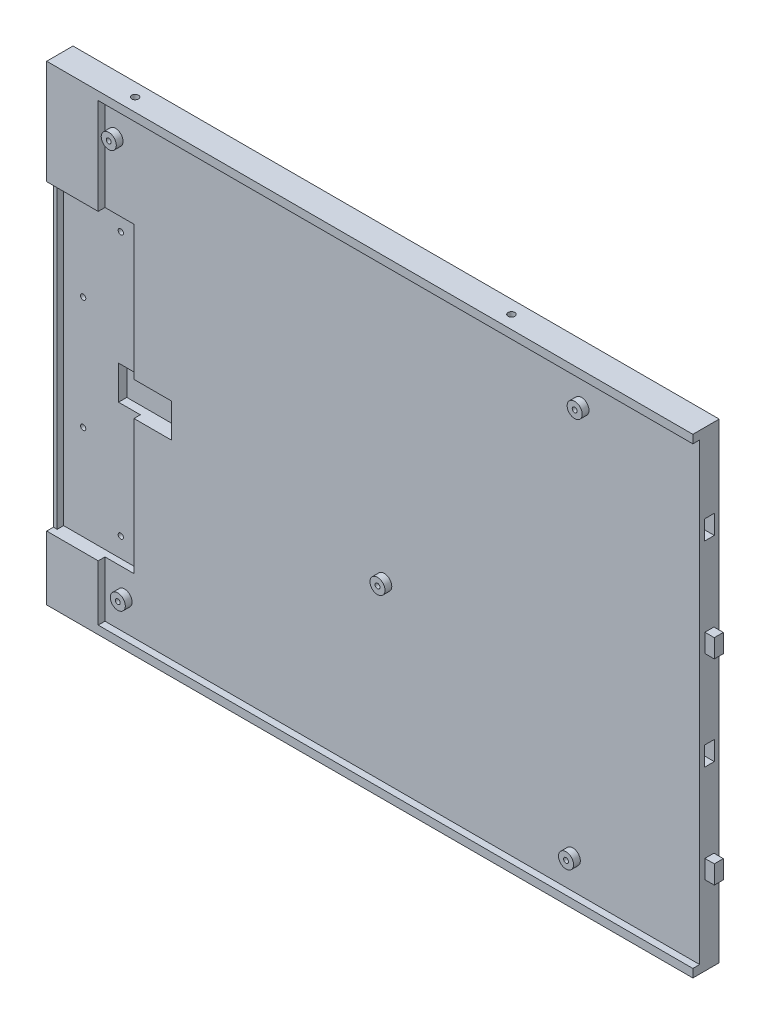
from build123d import *

# Parameters (mm, degrees)
SKETCH_1_W                      = 348.235
SKETCH_1_H                      = 124.714
EXTRUDE_1_DEPTH                 = 7
SKETCH_2_W                      = 344.235
SKETCH_2_H                      = 120.714
CUT_EXTRUDE_1_DEPTH             = 1.8
SKETCH_3_R                      = 2
SKETCH_3_R_2                    = 0.65
EXTRUDE_2_DEPTH                 = 1.8
CUT_EXTRUDE_2_DEPTH             = 370.930043415
CUT_EXTRUDE_2_DEPTH_BACK        = 1.7
SKETCH_4_W                      = 9.7
SKETCH_4_H                      = 80.4
SKETCH_6_W                      = 15.8
SKETCH_6_H                      = 9
CUT_EXTRUDE_3_DEPTH             = 3.9
SKETCH_7_W                      = 3.5
SKETCH_7_H                      = 80.4
EXTRUDE_3_DEPTH                 = 11.7
SKETCH_8_R                      = 0.7
CUT_EXTRUDE_4_DEPTH             = 3
SKETCH_9_W                      = 1
SKETCH_9_H                      = 80.4
EXTRUDE_4_DEPTH                 = 1.7
CUT_EXTRUDE_5_DEPTH             = 370.930043415
CUT_EXTRUDE_5_DEPTH_BACK        = 1.7
SKETCH_10_W                     = 20.2
SKETCH_10_H                     = 80.4
CUT_EXTRUDE_6_DEPTH             = 370.910052609
CUT_EXTRUDE_6_DEPTH_BACK        = 2.2
SKETCH_11_W                     = 15.8
SKETCH_11_H                     = 11.5
SKETCH_12_R                     = 0.65
CUT_EXTRUDE_7_DEPTH             = 3
SKETCH_13_W                     = 3
SKETCH_13_H                     = 124.714
EXTRUDE_5_DEPTH                 = 7
CUT_EXTRUDE_8_REACH             = 374.755
SKETCH_14_W                     = 6
SKETCH_14_H                     = 96.714
CUT_EXTRUDE_8_DIRECTION_2_DEPTH = 3
SKETCH_15_R                     = 2.6
CUT_EXTRUDE_9_DEPTH             = 0.7
SKETCH_15_3_R                   = 1
CUT_EXTRUDE_10_DEPTH            = 2.8
SKETCH_16_W                     = 362.935
SKETCH_16_H                     = 7
EXTRUDE_6_DEPTH                 = 0.2
SKETCH_17_W                     = 362.935
SKETCH_17_H                     = 7
EXTRUDE_7_DEPTH                 = 0.2
SKETCH_18_W                     = 10.4
SKETCH_18_H                     = 8.2
CUT_EXTRUDE_11_DEPTH            = 1.2
SKETCH_19_W                     = 4.2
SKETCH_19_H                     = 4.6
CUT_EXTRUDE_12_DEPTH            = 2.2
SKETCH_20_W                     = 10
SKETCH_20_H                     = 0.5
EXTRUDE_8_DEPTH                 = 0.8
SKETCH_21_W                     = 5.8
SKETCH_21_H                     = 1.6
EXTRUDE_9_DEPTH                 = 2.2
SKETCH_22_W                     = 13
SKETCH_22_H                     = 13
CUT_EXTRUDE_13_DEPTH            = 2.8
SKETCH_23_R                     = 5.6
SKETCH_23_R_2                   = 4.1
CUT_EXTRUDE_14_DEPTH            = 1
SKETCH_24_R                     = 0.9
CUT_EXTRUDE_15_DEPTH            = 3
CUT_EXTRUDE_START               = -122.114
SKETCH_24_2_R                   = 0.9
CUT_EXTRUDE_16_DEPTH            = 3
CUT_EXTRUDE_8779_DEPTH          = 373.822441145
CUT_EXTRUDE_8779_DEPTH_BACK     = 373.822441145
SKETCH_25_OUTSIDE_W             = 441.925
SKETCH_25_OUTSIDE_H             = 207.104
SKETCH_25_OUTSIDE_W_2           = 175.474128517
SKETCH_25_OUTSIDE_H_2           = 185.344548245
SKETCH_26_W                     = 2.6
SKETCH_26_H                     = 5.1
CUT_EXTRUDE_18_DEPTH            = 3
SKETCH_26_3_W                   = 2.4
SKETCH_26_3_H                   = 4.9
EXTRUDE_10_DEPTH                = 2.5


with BuildPart() as part:
    # 草图1 → 凸台-拉伸1 (new body)
    with BuildSketch(Plane.XY):
        with Locations((174.1175, -62.357)):
            Rectangle(SKETCH_1_W, SKETCH_1_H)
    extrude(amount=EXTRUDE_1_DEPTH)

    # 草图2 → 切除-拉伸1 (cut)
    with BuildSketch(Plane.XY.offset(7)):
        with Locations((174.1175, -62.357)):
            Rectangle(SKETCH_2_W, SKETCH_2_H)
    extrude(amount=-CUT_EXTRUDE_1_DEPTH, mode=Mode.SUBTRACT)

    # 草图3 → 凸台-拉伸2 (add)
    # profile 1 of 11: a face of its own
    with BuildSketch(Plane.XY.offset(5.2)):
        with Locations((4.8, -9.9)):
            Circle(SKETCH_3_R)
        with Locations((4.8, -9.9)):
            Circle(SKETCH_3_R_2, mode=Mode.SUBTRACT)
    # profile 2 of 11: a face of its own
    with BuildSketch(Plane.XY.offset(5.2)):
        with Locations((7.2, -114.7)):
            Circle(SKETCH_3_R)
        with Locations((7.2, -114.7)):
            Circle(SKETCH_3_R_2, mode=Mode.SUBTRACT)
    # profile 3 of 11: a face of its own
    with BuildSketch(Plane.XY.offset(5.2)):
        with Locations((76.2, -76.6)):
            Circle(SKETCH_3_R)
        with Locations((76.2, -76.6)):
            Circle(SKETCH_3_R_2, mode=Mode.SUBTRACT)
    # profile 4 of 11: a face of its own
    with BuildSketch(Plane.XY.offset(5.2)):
        with Locations((128.6, -9.9)):
            Circle(SKETCH_3_R)
        with Locations((128.6, -9.9)):
            Circle(SKETCH_3_R_2, mode=Mode.SUBTRACT)
    # profile 5 of 11: a face of its own
    with BuildSketch(Plane.XY.offset(5.2)):
        with Locations((126.3, -114.7)):
            Circle(SKETCH_3_R)
        with Locations((126.3, -114.7)):
            Circle(SKETCH_3_R_2, mode=Mode.SUBTRACT)
    # profile 6 of 11: a face of its own
    with BuildSketch(Plane.XY.offset(5.2)):
        with Locations((185.8, -57.5)):
            Circle(SKETCH_3_R)
        with Locations((185.8, -57.5)):
            Circle(SKETCH_3_R_2, mode=Mode.SUBTRACT)
    # profile 7 of 11: a face of its own
    with BuildSketch(Plane.XY.offset(5.2)):
        with Locations((252.5, -9.9)):
            Circle(SKETCH_3_R)
        with Locations((252.5, -9.9)):
            Circle(SKETCH_3_R_2, mode=Mode.SUBTRACT)
    # profile 8 of 11: a face of its own
    with BuildSketch(Plane.XY.offset(5.2)):
        with Locations((245.3, -114.7)):
            Circle(SKETCH_3_R)
        with Locations((245.3, -114.7)):
            Circle(SKETCH_3_R_2, mode=Mode.SUBTRACT)
    # profile 9 of 11: a face of its own
    with BuildSketch(Plane.XY.offset(5.2)):
        with Locations((333.4, -9.9)):
            Circle(SKETCH_3_R)
        with Locations((333.4, -9.9)):
            Circle(SKETCH_3_R_2, mode=Mode.SUBTRACT)
    # profile 10 of 11: a face of its own
    with BuildSketch(Plane.XY.offset(5.2)):
        with Locations((333.4, -114.7)):
            Circle(SKETCH_3_R)
        with Locations((333.4, -114.7)):
            Circle(SKETCH_3_R_2, mode=Mode.SUBTRACT)
    # profile 11 of 11: a face of its own
    with BuildSketch(Plane.XY.offset(5.2)):
        with Locations((266.8, -57.5)):
            Circle(SKETCH_3_R)
        with Locations((266.8, -57.5)):
            Circle(SKETCH_3_R_2, mode=Mode.SUBTRACT)
    extrude(amount=EXTRUDE_2_DEPTH)

    # 草图4 → 切除-拉伸2 (cut, two sides: drawn at the far end of the back side and taken through both)
    with BuildSketch(Plane.XY.offset(5.2).offset(-CUT_EXTRUDE_2_DEPTH_BACK)):
        with Locations((4.85, -67.714)):
            Rectangle(SKETCH_4_W, SKETCH_4_H)
    extrude(amount=CUT_EXTRUDE_2_DEPTH + CUT_EXTRUDE_2_DEPTH_BACK, mode=Mode.SUBTRACT)

    # 草图6 → 切除-拉伸3 (cut)
    with BuildSketch(Plane.XY.offset(5.2)):
        with Locations((11.8, -67.714)):
            Rectangle(SKETCH_6_W, SKETCH_6_H)
    extrude(amount=-CUT_EXTRUDE_3_DEPTH, mode=Mode.SUBTRACT)

    # 草图7 → 凸台-拉伸3 (add)
    with BuildSketch(Plane.ZY):
        Polygon((7, 0), (0, 0), (0, -27.514), (3.5, -27.514), (7, -27.514), align=None)
        with Locations((1.75, -67.714)):
            Rectangle(SKETCH_7_W, SKETCH_7_H)
        Polygon((3.5, -107.914), (0, -107.914), (0, -124.714), (7, -124.714), (7, -107.914), align=None)
    extrude(amount=EXTRUDE_3_DEPTH)

    # 草图8 → 切除-拉伸4 (cut)
    with BuildSketch(Plane.XY.offset(3.5)):
        with Locations((-5.5, -82.714)):
            Circle(SKETCH_8_R)
        with Locations((4.5, -102.714)):
            Circle(SKETCH_8_R)
        with Locations((-5.5, -52.714)):
            Circle(SKETCH_8_R)
        with Locations((4.5, -32.714)):
            Circle(SKETCH_8_R)
    extrude(amount=-CUT_EXTRUDE_4_DEPTH, mode=Mode.SUBTRACT)

    # 草图9 → 凸台-拉伸4 (add)
    with BuildSketch(Plane.XY.offset(3.5)):
        with Locations((-11.2, -67.714)):
            Rectangle(SKETCH_9_W, SKETCH_9_H)
    extrude(amount=EXTRUDE_4_DEPTH)

    # 草图10 → 切除-拉伸5 (cut, two sides: drawn at the far end of the back side and taken through both)
    with BuildSketch(Plane.XY.offset(5.2).offset(-CUT_EXTRUDE_5_DEPTH_BACK)):
        with Locations((338.135, -70.514)):
            Rectangle(SKETCH_10_W, SKETCH_10_H)
    extrude(amount=CUT_EXTRUDE_5_DEPTH + CUT_EXTRUDE_5_DEPTH_BACK, mode=Mode.SUBTRACT)

    # 草图11 → 切除-拉伸6 (cut, two sides: drawn at the far end of the back side and taken through both)
    with BuildSketch(Plane.XY.offset(3.5).offset(-CUT_EXTRUDE_6_DEPTH_BACK)):
        with Locations((325.935, -70.514)):
            Rectangle(SKETCH_11_W, SKETCH_11_H)
    extrude(amount=CUT_EXTRUDE_6_DEPTH + CUT_EXTRUDE_6_DEPTH_BACK, mode=Mode.SUBTRACT)

    # 草图12 → 切除-拉伸7 (cut)
    with BuildSketch(Plane.XY.offset(3.5)):
        with Locations((331.235, -107.514)):
            Circle(SKETCH_12_R)
        with Locations((340.235, -86.514)):
            Circle(SKETCH_12_R)
        with Locations((340.235, -54.514)):
            Circle(SKETCH_12_R)
        with Locations((331.235, -33.514)):
            Circle(SKETCH_12_R)
    extrude(amount=-CUT_EXTRUDE_7_DEPTH, mode=Mode.SUBTRACT)

    # 草图13 → 凸台-拉伸5 (add)
    with BuildSketch(Plane(origin=(0, 0, 0), x_dir=(-1, 0, 0), z_dir=(0, 0, -1))):
        with Locations((-349.735, -62.357)):
            Rectangle(SKETCH_13_W, SKETCH_13_H)
    extrude(amount=-EXTRUDE_5_DEPTH)

    # 切除-拉伸8: up to this face of the body (flat: up to its plane)
    cut_extrude_8_end = Plane(part.part.faces().sort_by_distance((338.452628763, -70.514, 3.5))[0])
    # 草图14 → 切除-拉伸8 (cut, up to the picked face)
    with BuildSketch(Plane.XY.offset(5.2), mode=Mode.PRIVATE) as cut_extrude_8_sk1:
        with Locations((345.435, -62.357)):
            Rectangle(SKETCH_14_W, SKETCH_14_H)
    cut_extrude_8_tool1 = split(extrude(cut_extrude_8_sk1.sketch, amount=-CUT_EXTRUDE_8_REACH, mode=Mode.PRIVATE), bisect_by=cut_extrude_8_end, keep=Keep.BOTH, mode=Mode.PRIVATE)
    add(cut_extrude_8_tool1.solids().sort_by(Axis((345.435, -62.357, 5.2), (0, 0, -1)))[0], mode=Mode.SUBTRACT)

    # 草图14 → 切除-拉伸8 direction 2 (cut)
    with BuildSketch(Plane.XY.offset(5.2)):
        with Locations((345.435, -62.357)):
            Rectangle(SKETCH_14_W, SKETCH_14_H)
    extrude(amount=CUT_EXTRUDE_8_DIRECTION_2_DEPTH, mode=Mode.SUBTRACT)

    # 草图15 → 切除-拉伸9 (cut)
    with BuildSketch(Plane(origin=(351.235, 0, 0), x_dir=(0, 0, -1), z_dir=(1, 0, 0))):
        with Locations((-3.5, -20)):
            Circle(SKETCH_15_R)
        with Locations((-3.5, -27.701272727)):
            Circle(SKETCH_15_R)
        with Locations((-3.5, -35.402545455)):
            Circle(SKETCH_15_R)
        with Locations((-3.5, -43.103818182)):
            Circle(SKETCH_15_R)
        with Locations((-3.5, -50.805090909)):
            Circle(SKETCH_15_R)
        with Locations((-3.5, -58.506363636)):
            Circle(SKETCH_15_R)
        with Locations((-3.5, -66.207636364)):
            Circle(SKETCH_15_R)
        with Locations((-3.5, -73.908909091)):
            Circle(SKETCH_15_R)
        with Locations((-3.5, -81.610181818)):
            Circle(SKETCH_15_R)
        with Locations((-3.5, -89.311454545)):
            Circle(SKETCH_15_R)
        with Locations((-3.5, -97.012727273)):
            Circle(SKETCH_15_R)
    extrude(amount=-CUT_EXTRUDE_9_DEPTH, mode=Mode.SUBTRACT)

    # 草图15<3> → 切除-拉伸10 (cut)
    with BuildSketch(Plane(origin=(351.235, 0, 0), x_dir=(0, 0, -1), z_dir=(1, 0, 0))):
        with Locations((-3.5, -20)):
            Circle(SKETCH_15_3_R)
        with Locations((-3.5, -27.701272727)):
            Circle(SKETCH_15_3_R)
        with Locations((-3.5, -35.402545455)):
            Circle(SKETCH_15_3_R)
        with Locations((-3.5, -43.103818182)):
            Circle(SKETCH_15_3_R)
        with Locations((-3.5, -50.805090909)):
            Circle(SKETCH_15_3_R)
        with Locations((-3.5, -58.506363636)):
            Circle(SKETCH_15_3_R)
        with Locations((-3.5, -66.207636364)):
            Circle(SKETCH_15_3_R)
        with Locations((-3.5, -73.908909091)):
            Circle(SKETCH_15_3_R)
        with Locations((-3.5, -81.610181818)):
            Circle(SKETCH_15_3_R)
        with Locations((-3.5, -89.311454545)):
            Circle(SKETCH_15_3_R)
        with Locations((-3.5, -97.012727273)):
            Circle(SKETCH_15_3_R)
    extrude(amount=-CUT_EXTRUDE_10_DEPTH, mode=Mode.SUBTRACT)

    # 草图16 → 凸台-拉伸6 (add)
    with BuildSketch(Plane(origin=(0, 0, 0), x_dir=(1, 0, 0), z_dir=(0, 1, 0))):
        with Locations((169.7675, -3.5)):
            Rectangle(SKETCH_16_W, SKETCH_16_H)
    extrude(amount=EXTRUDE_6_DEPTH)

    # 草图17 → 凸台-拉伸7 (add)
    with BuildSketch(Plane.XZ.offset(124.714)):
        with Locations((169.7675, 3.5)):
            Rectangle(SKETCH_17_W, SKETCH_17_H)
    extrude(amount=EXTRUDE_7_DEPTH)

    # 草图18 → 切除-拉伸11 (cut)
    with BuildSketch(Plane(origin=(0, 0.2, 0), x_dir=(1, 0, 0), z_dir=(0, 1, 0))):
        with Locations((169.7675, -4.6)):
            Rectangle(SKETCH_18_W, SKETCH_18_H)
    extrude(amount=-CUT_EXTRUDE_11_DEPTH, mode=Mode.SUBTRACT)

    # 草图19 → 切除-拉伸12 (cut)
    with BuildSketch(Plane(origin=(0, 0.2, 0), x_dir=(1, 0, 0), z_dir=(0, 1, 0))):
        with Locations((169.7675, -4.7)):
            Rectangle(SKETCH_19_W, SKETCH_19_H)
    extrude(amount=-CUT_EXTRUDE_12_DEPTH, mode=Mode.SUBTRACT)

    # 草图20 → 凸台-拉伸8 (add)
    with BuildSketch(Plane(origin=(0, 0.2, 0), x_dir=(1, 0, 0), z_dir=(0, 1, 0))):
        with Locations((169.7675, -0.25)):
            Rectangle(SKETCH_20_W, SKETCH_20_H)
    extrude(amount=EXTRUDE_8_DEPTH)

    # 草图21 → 凸台-拉伸9 (add)
    with BuildSketch(Plane(origin=(0, 1, 0), x_dir=(1, 0, 0), z_dir=(0, 1, 0))):
        with Locations((169.7675, -0.8)):
            Rectangle(SKETCH_21_W, SKETCH_21_H)
    extrude(amount=EXTRUDE_9_DEPTH)

    # 草图22 → 切除-拉伸13 (cut)
    with BuildSketch(Plane.XY.offset(5.2)):
        Polygon((171.8675, -2), (167.6675, -2), (167.6675, -6), (199.2675, -6), (212.2675, -6), (212.2675, -2), align=None)
        with Locations((205.7675, -12.5)):
            Rectangle(SKETCH_22_W, SKETCH_22_H)
    extrude(amount=-CUT_EXTRUDE_13_DEPTH, mode=Mode.SUBTRACT)

    # 草图23 → 切除-拉伸14 (cut)
    with BuildSketch(Plane(origin=(0, 0, 0), x_dir=(-1, 0, 0), z_dir=(0, 0, -1))):
        with Locations((-331.235, -19.8)):
            Circle(SKETCH_23_R)
        with Locations((-231.235, -19.8)):
            Circle(SKETCH_23_R)
        with Locations((-108.3, -19.8)):
            Circle(SKETCH_23_R)
        with Locations((-8.3, -19.8)):
            Circle(SKETCH_23_R)
        with Locations((-331.235, -104.914)):
            Circle(SKETCH_23_R_2)
        with Locations((-231.235, -104.914)):
            Circle(SKETCH_23_R_2)
        with Locations((-108.3, -104.914)):
            Circle(SKETCH_23_R_2)
        with Locations((-8.3, -104.914)):
            Circle(SKETCH_23_R_2)
    extrude(amount=-CUT_EXTRUDE_14_DEPTH, mode=Mode.SUBTRACT)

    # 草图24 → 切除-拉伸15 (cut)
    with BuildSketch(Plane(origin=(0, 0.2, 0), x_dir=(1, 0, 0), z_dir=(0, 1, 0))):
        with Locations(Location((8.3, -3.5, 0), (0, 0, 270))):
            Circle(SKETCH_24_R)
        with Locations(Location((108.3, -3.5, 0), (0, 0, 270))):
            Circle(SKETCH_24_R)
        with Locations(Location((231.235, -3.5, 0), (0, 0, 270))):
            Circle(SKETCH_24_R)
        with Locations(Location((331.235, -3.5, 0), (0, 0, 270))):
            Circle(SKETCH_24_R)
    extrude(amount=-CUT_EXTRUDE_15_DEPTH, mode=Mode.SUBTRACT)

    # 草图24<2> → 切除-拉伸16 (cut)
    with BuildSketch(Plane(origin=(0, 0.2, 0), x_dir=(1, 0, 0), z_dir=(0, 1, 0)).offset(CUT_EXTRUDE_START)):
        with Locations(Location((8.3, -3.5, 0), (0, 0, 270))):
            Circle(SKETCH_24_2_R)
        with Locations(Location((108.3, -3.5, 0), (0, 0, 270))):
            Circle(SKETCH_24_2_R)
        with Locations(Location((231.235, -3.5, 0), (0, 0, 270))):
            Circle(SKETCH_24_2_R)
        with Locations(Location((331.235, -3.5, 0), (0, 0, 270))):
            Circle(SKETCH_24_2_R)
    extrude(amount=-CUT_EXTRUDE_16_DEPTH, mode=Mode.SUBTRACT)

    # 草图25 outside → Cut-Extrude 8779 (cut, two sides: drawn at the far end of the back side and taken through both)
    with BuildSketch(Plane.XY.offset(5.2).offset(-CUT_EXTRUDE_8779_DEPTH_BACK)):
        with Locations((169.7675, -60.857)):
            Rectangle(SKETCH_25_OUTSIDE_W, SKETCH_25_OUTSIDE_H)
        with Locations((72.262935742, -51.035724743)):
            Rectangle(SKETCH_25_OUTSIDE_W_2, SKETCH_25_OUTSIDE_H_2, mode=Mode.SUBTRACT)
    extrude(amount=CUT_EXTRUDE_8779_DEPTH + CUT_EXTRUDE_8779_DEPTH_BACK, mode=Mode.SUBTRACT)

    # 草图26 → 切除-拉伸18 (cut)
    with BuildSketch(Plane(origin=(160, 0, 0), x_dir=(0, 0, -1), z_dir=(1, 0, 0))):
        with Locations((-2.6, -75.4184)):
            Rectangle(SKETCH_26_W, SKETCH_26_H)
        with Locations((-2.6, -23.3728)):
            Rectangle(SKETCH_26_W, SKETCH_26_H)
    extrude(amount=-CUT_EXTRUDE_18_DEPTH, mode=Mode.SUBTRACT)

    # 草图26<3> → 凸台-拉伸10 (add)
    with BuildSketch(Plane(origin=(160, 0, 0), x_dir=(0, 0, -1), z_dir=(1, 0, 0))):
        with Locations((-2.6, -101.4412)):
            Rectangle(SKETCH_26_3_W, SKETCH_26_3_H)
        with Locations((-2.6, -49.3956)):
            Rectangle(SKETCH_26_3_W, SKETCH_26_3_H)
    extrude(amount=EXTRUDE_10_DEPTH)


solid = part.part
